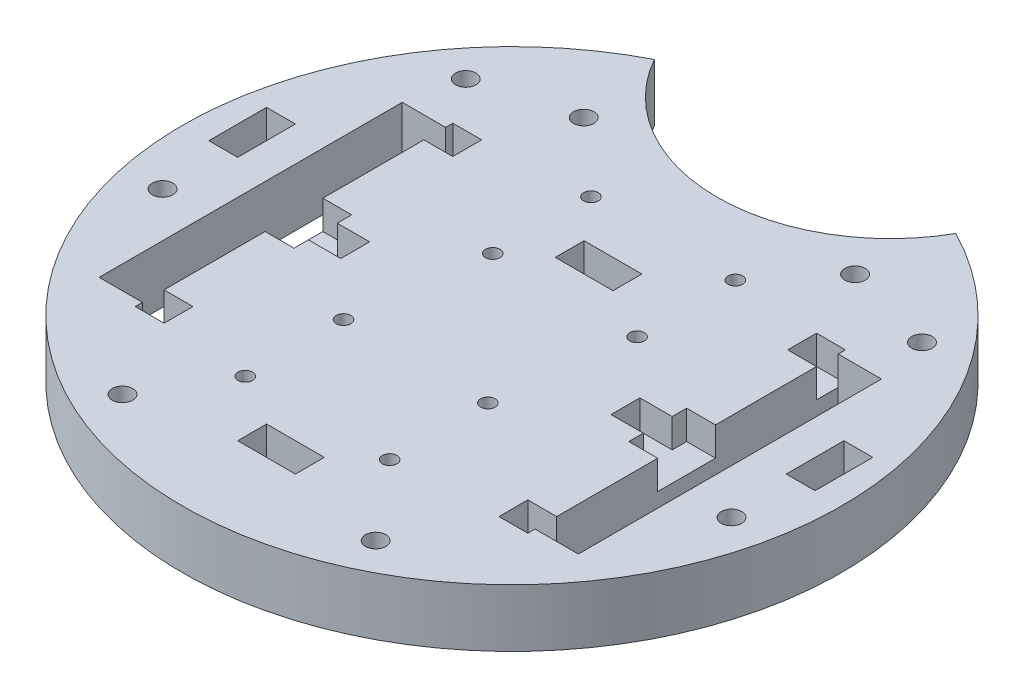
from build123d import *

# Parameters (mm, degrees)
BOSS_EXTRUDE1_DEPTH     = 12.7
SKETCH2_W               = 9.525
SKETCH2_H               = 66.675
CUT_EXTRUDE1_DEPTH      = 104.314035833
CUT_EXTRUDE2_DEPTH      = 104.314035833
CUT_EXTRUDE2_DEPTH_BACK = 104.314035833
SKETCH3_R               = 1.5999968
SKETCH8_W               = 6.35
SKETCH8_H               = 6.35
CUT_EXTRUDE3_DEPTH      = 6.35
SKETCH9_R               = 2.15265
CUT_EXTRUDE4_DEPTH      = 6.35
F_8_CLEARANCE_HOLE1_D   = 4.4958
SKETCH13_R              = 2.921
CUT_EXTRUDE6_DEPTH      = 6.35
CUT_EXTRUDE7_DEPTH      = 6.35
SKETCH15_W              = 12.7
SKETCH15_H              = 6.35
SKETCH15_W_2            = 6.35
SKETCH15_H_2            = 12.7
CUT_EXTRUDE8_DEPTH      = 104.314035833


with BuildPart() as part:
    # Sketch1 → Boss-Extrude1 (new body)
    with BuildSketch(Plane(origin=(0, 0, 0), x_dir=(1, 0, 0), z_dir=(0, 1, 0))):
        with BuildLine():
            ThreePointArc((-33.160552015, 64.471914738), (-37.763143268, -61.888569304), (72.5, 0))
            ThreePointArc((72.5, 0), (61.888569304, 37.763143268), (33.160552015, 64.471914738))
            ThreePointArc((33.160552015, 64.471914738), (0, 45.133252378), (-33.160552015, 64.471914738))
        make_face()
    extrude(amount=BOSS_EXTRUDE1_DEPTH)

    # Sketch2 → Cut-Extrude1 (cut, through all)
    with BuildSketch(Plane(origin=(0, 12.7, 0), x_dir=(1, 0, 0), z_dir=(0, 1, 0))):
        with Locations((47.9425, -4.7625)):
            Rectangle(SKETCH2_W, SKETCH2_H)
        with Locations((-47.9425, -4.7625)):
            Rectangle(SKETCH2_W, SKETCH2_H)
    extrude(amount=-CUT_EXTRUDE1_DEPTH, mode=Mode.SUBTRACT)

    # Sketch3 → Cut-Extrude2 (cut, two sides: drawn at the far end of the back side and taken through both)
    with BuildSketch(Plane(origin=(0, 12.7, 0), x_dir=(1, 0, 0), z_dir=(0, 1, 0)).offset(-CUT_EXTRUDE2_DEPTH_BACK)):
        with Locations(Location((-17.78, -40.871568, 0), (0, 0, 270))):
            Circle(SKETCH3_R)
        with Locations(Location((13.97, -40.871568, 0), (0, 0, 270))):
            Circle(SKETCH3_R)
        with Locations(Location((13.97, -19.271568, 0), (0, 0, 270))):
            Circle(SKETCH3_R)
        with Locations(Location((-17.78, -19.271568, 0), (0, 0, 270))):
            Circle(SKETCH3_R)
        with Locations(Location((-13.97, 9.746568, 0), (0, 0, 270))):
            Circle(SKETCH3_R)
        with Locations(Location((17.78, 9.746568, 0), (0, 0, 270))):
            Circle(SKETCH3_R)
        with Locations(Location((17.78, 31.346568, 0), (0, 0, 270))):
            Circle(SKETCH3_R)
        with Locations(Location((-13.97, 31.346568, 0), (0, 0, 270))):
            Circle(SKETCH3_R)
    extrude(amount=CUT_EXTRUDE2_DEPTH + CUT_EXTRUDE2_DEPTH_BACK, mode=Mode.SUBTRACT)

    # Sketch8 → Cut-Extrude3 (cut)
    with BuildSketch(Plane(origin=(0, 12.7, 0), x_dir=(1, 0, 0), z_dir=(0, 1, 0))):
        Polygon((-36.83, -11.1125), (-43.18, -11.1125), (-43.18, 1.5875), (-36.83, 1.5875), (-36.83, -1.5875), (-29.718, -1.5875), (-29.718, -7.9375), (-36.83, -7.9375), align=None)
        with Locations((-40.005, -36.5125)):
            Rectangle(SKETCH8_W, SKETCH8_H)
        with Locations((-40.005, 26.9875)):
            Rectangle(SKETCH8_W, SKETCH8_H)
    cut_extrude3 = extrude(amount=-CUT_EXTRUDE3_DEPTH, mode=Mode.SUBTRACT)

    # Mirror1: Cut-Extrude3 across plane
    add(cut_extrude3.mirror(Plane(origin=(0, 0, 0), x_dir=(0, 0, 1), z_dir=(1, 0, 0))), mode=Mode.SUBTRACT)

    # Sketch9 → Cut-Extrude4 (cut)
    # profile 1 of 8: a face of its own
    with BuildSketch(Plane.XZ):
        Polygon((47.68611883, -44.334510718), (52.672115754, -44.334510718), (55.165114217, -40.016510718), (52.672115754, -35.698510718), (47.68611883, -35.698510718), (45.193120367, -40.016510718), align=None)
        with Locations(Location((50.179117292, -40.016510718, 0), (0, 0, 270))):
            Circle(SKETCH9_R, mode=Mode.SUBTRACT)
    # profile 2 of 8: a face of its own
    with BuildSketch(Plane.XZ):
        Polygon((64.39392502, 9.640393675), (67.502643254, 13.538603042), (65.68105403, 18.17993669), (60.750746572, 18.923060971), (57.642028337, 15.024851604), (59.463617561, 10.383517955), align=None)
        with Locations(Location((62.572335796, 14.281727323, 0), (0, 0, 270))):
            Circle(SKETCH9_R, mode=Mode.SUBTRACT)
    # profile 3 of 8: a face of its own
    with BuildSketch(Plane.XZ):
        Polygon((32.611792273, 56.355885002), (31.502303581, 61.216872574), (26.73782051, 62.686520967), (23.082826131, 59.295181788), (24.192314824, 54.434194216), (28.956797895, 52.964545823), align=None)
        with Locations(Location((27.847309202, 57.825533395, 0), (0, 0, 270))):
            Circle(SKETCH9_R, mode=Mode.SUBTRACT)
    # profile 4 of 8: a face of its own
    with BuildSketch(Plane.XZ):
        Polygon((-23.727685214, 60.634245472), (-28.219913219, 62.797588461), (-32.339537207, 59.988876384), (-31.96693319, 55.016821318), (-27.474705185, 52.853478329), (-23.355081198, 55.662190406), align=None)
        with Locations(Location((-27.847309202, 57.825533395, 0), (0, 0, 270))):
            Circle(SKETCH9_R, mode=Mode.SUBTRACT)
    # profile 5 of 8: a face of its own
    with BuildSketch(Plane.XZ):
        Polygon((-53.834111671, -36.625171539), (-54.943600363, -41.486159111), (-51.288605984, -44.87749829), (-46.524122913, -43.407849897), (-45.414634221, -38.546862325), (-49.0696286, -35.155523146), align=None)
        with Locations(Location((-50.179117292, -40.016510718, 0), (0, 0, 270))):
            Circle(SKETCH9_R, mode=Mode.SUBTRACT)
    # profile 6 of 8: a face of its own
    with BuildSketch(Plane.XZ):
        Polygon((-62.199731779, 19.253782389), (-66.691959784, 17.0904394), (-67.0645638, 12.118384334), (-62.944939813, 9.309672257), (-58.452711808, 11.473015246), (-58.080107791, 16.445070312), align=None)
        with Locations(Location((-62.572335796, 14.281727323, 0), (0, 0, 270))):
            Circle(SKETCH9_R, mode=Mode.SUBTRACT)
    # profile 7 of 8: a face of its own
    with BuildSketch(Plane.XZ):
        Polygon((-32.337998462, -49.950028848), (-27.352001538, -49.950028848), (-24.859003075, -45.632028848), (-27.352001538, -41.314028848), (-32.337998462, -41.314028848), (-34.830996925, -45.632028848), align=None)
        with Locations(Location((-29.845, -45.632028848, 0), (0, 0, 270))):
            Circle(SKETCH9_R, mode=Mode.SUBTRACT)
    # profile 8 of 8: a face of its own
    with BuildSketch(Plane.XZ):
        Polygon((27.352001538, -49.950028848), (32.337998462, -49.950028848), (34.830996925, -45.632028848), (32.337998462, -41.314028848), (27.352001538, -41.314028848), (24.859003075, -45.632028848), align=None)
        with Locations(Location((29.845, -45.632028848, 0), (0, 0, 270))):
            Circle(SKETCH9_R, mode=Mode.SUBTRACT)
    extrude(amount=-CUT_EXTRUDE4_DEPTH, mode=Mode.SUBTRACT)

    # #8 Clearance Hole1 (through all)
    with Locations(Plane(origin=(0, 0, 0), x_dir=(-1, 0, 0), z_dir=(0, -1, 0))):
        with Locations((-50.179117292, 40.016510718), (-62.572335796, -14.281727323), (-27.847309202, -57.825533395), (27.847309202, -57.825533395), (62.572335796, -14.281727323), (50.179117292, 40.016510718), (-29.845, 45.632028848), (29.845, 45.632028848)):
            Hole(F_8_CLEARANCE_HOLE1_D / 2)

    # Sketch13 → Cut-Extrude6 (cut)
    with BuildSketch(Plane.XZ):
        with Locations(Location((0, 63.5, 0), (0, 0, 270))):
            Circle(SKETCH13_R)
        with Locations(Location((0, -38.1, 0), (0, 0, 270))):
            Circle(SKETCH13_R)
    extrude(amount=-CUT_EXTRUDE6_DEPTH, mode=Mode.SUBTRACT)

    # Sketch14 → Cut-Extrude7 (cut)
    with BuildSketch(Plane.XZ):
        Polygon((21.372850725, -31.346568), (19.576425363, -28.235068), (15.983574637, -28.235068), (14.187149275, -31.346568), (15.983574637, -34.458068), (19.576425363, -34.458068), align=None)
        Polygon((-10.377149275, -9.746568), (-12.173574637, -6.635068), (-15.766425363, -6.635068), (-17.562850725, -9.746568), (-15.766425363, -12.858068), (-12.173574637, -12.858068), align=None)
        Polygon((-10.377149275, -31.346568), (-12.173574637, -28.235068), (-15.766425363, -28.235068), (-17.562850725, -31.346568), (-15.766425363, -34.458068), (-12.173574637, -34.458068), align=None)
        Polygon((14.187149275, -9.746568), (15.983574637, -12.858068), (19.576425363, -12.858068), (21.372850725, -9.746568), (19.576425363, -6.635068), (15.983574637, -6.635068), align=None)
        Polygon((17.562850725, 19.271568), (15.766425363, 22.383068), (12.173574637, 22.383068), (10.377149275, 19.271568), (12.173574637, 16.160068), (15.766425363, 16.160068), align=None)
        Polygon((-14.187149275, 19.271568), (-15.983574637, 22.383068), (-19.576425363, 22.383068), (-21.372850725, 19.271568), (-19.576425363, 16.160068), (-15.983574637, 16.160068), align=None)
        Polygon((-14.187149275, 40.871568), (-15.983574637, 43.983068), (-19.576425363, 43.983068), (-21.372850725, 40.871568), (-19.576425363, 37.760068), (-15.983574637, 37.760068), align=None)
        Polygon((10.377149275, 40.871568), (12.173574637, 37.760068), (15.766425363, 37.760068), (17.562850725, 40.871568), (15.766425363, 43.983068), (12.173574637, 43.983068), align=None)
    extrude(amount=-CUT_EXTRUDE7_DEPTH, mode=Mode.SUBTRACT)

    # Sketch15 → Cut-Extrude8 (cut, through all)
    with BuildSketch(Plane(origin=(0, 12.7, 0), x_dir=(1, 0, 0), z_dir=(0, 1, 0))):
        with Locations((0, 19.05)):
            Rectangle(SKETCH15_W, SKETCH15_H)
        with Locations((0, -50.8)):
            Rectangle(SKETCH15_W, SKETCH15_H)
        with Locations((-63.5, 6.35)):
            Rectangle(SKETCH15_W_2, SKETCH15_H_2)
        with Locations((63.5, 6.35)):
            Rectangle(SKETCH15_W_2, SKETCH15_H_2)
    extrude(amount=-CUT_EXTRUDE8_DEPTH, mode=Mode.SUBTRACT)


solid = part.part
